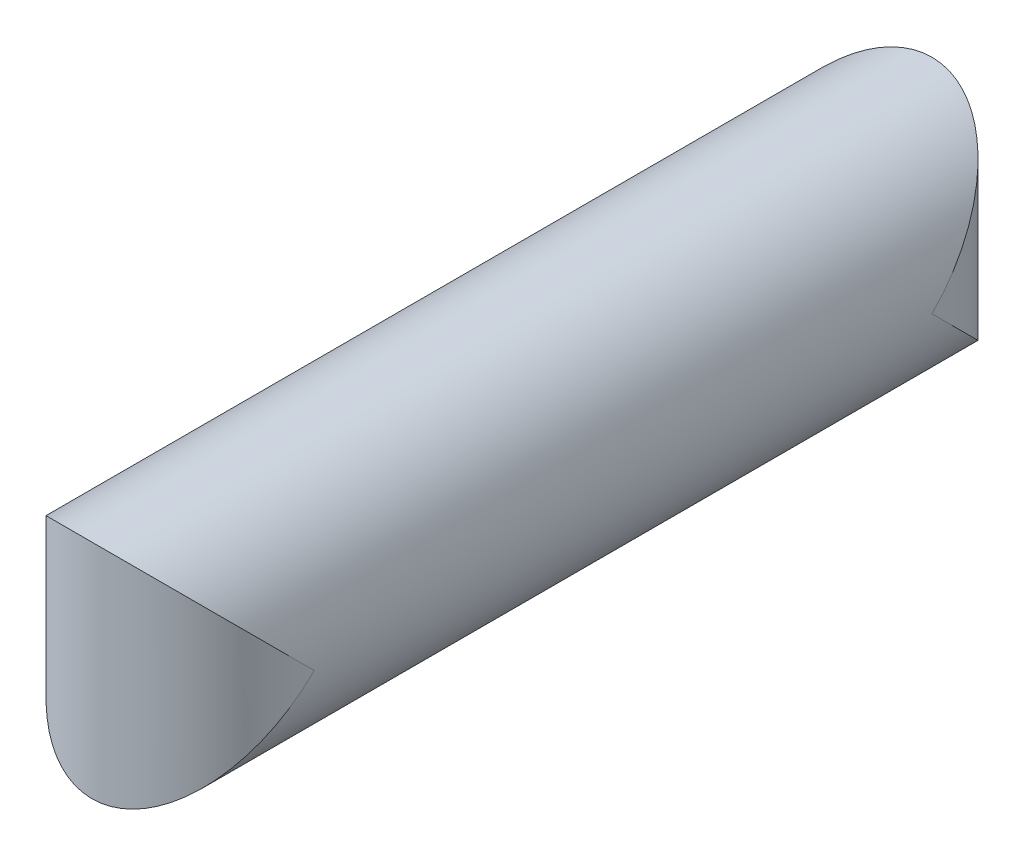
from build123d import *

# Parameters (mm, degrees)
SKETCH1_R               = 3.96875
BOSS_EXTRUDE1_DEPTH     = 30
CUT_EXTRUDE1_DEPTH      = 31.520516921
CUT_EXTRUDE1_DEPTH_BACK = 31.520516921
CUT_EXTRUDE2_DEPTH      = 31.520516921
CUT_EXTRUDE2_DEPTH_BACK = 31.520516921


with BuildPart() as part:
    # Sketch1 → Boss-Extrude1 (new body)
    with BuildSketch(Plane.XY):
        Circle(SKETCH1_R)
    extrude(amount=BOSS_EXTRUDE1_DEPTH)

    # Sketch2 → Cut-Extrude1 (cut, two sides: drawn at the far end of the back side and taken through both)
    with BuildSketch(Plane(origin=(0, 0, 0), x_dir=(1, 0, 0), z_dir=(0, 1, 0)).offset(-CUT_EXTRUDE1_DEPTH_BACK)):
        with BuildLine():
            ThreePointArc((0, -30), (-2.806330038, -28.837580038), (-3.96875, -26.03125))
            Line((-3.96875, -26.03125), (-3.96875, -30))
            Line((-3.96875, -30), (0, -30))
        make_face()
        with BuildLine():
            Line((3.96875, -30), (3.96875, -26.03125))
            ThreePointArc((3.96875, -26.03125), (2.806330038, -28.837580038), (0, -30))
            Line((0, -30), (3.96875, -30))
        make_face()
    extrude(amount=CUT_EXTRUDE1_DEPTH + CUT_EXTRUDE1_DEPTH_BACK, mode=Mode.SUBTRACT)

    # Sketch3 → Cut-Extrude2 (cut, two sides: drawn at the far end of the back side and taken through both)
    with BuildSketch(Plane(origin=(0, 0, 0), x_dir=(1, 0, 0), z_dir=(0, 1, 0)).offset(-CUT_EXTRUDE2_DEPTH_BACK)):
        with BuildLine():
            ThreePointArc((0, 0), (2.806330038, -1.162419962), (3.96875, -3.96875))
            Line((3.96875, -3.96875), (3.96875, 0))
            Line((3.96875, 0), (0, 0))
        make_face()
        with BuildLine():
            Line((-3.96875, 0), (-3.96875, -3.96875))
            ThreePointArc((-3.96875, -3.96875), (-2.806330038, -1.162419962), (0, 0))
            Line((0, 0), (-3.96875, 0))
        make_face()
    extrude(amount=CUT_EXTRUDE2_DEPTH + CUT_EXTRUDE2_DEPTH_BACK, mode=Mode.SUBTRACT)


solid = part.part
